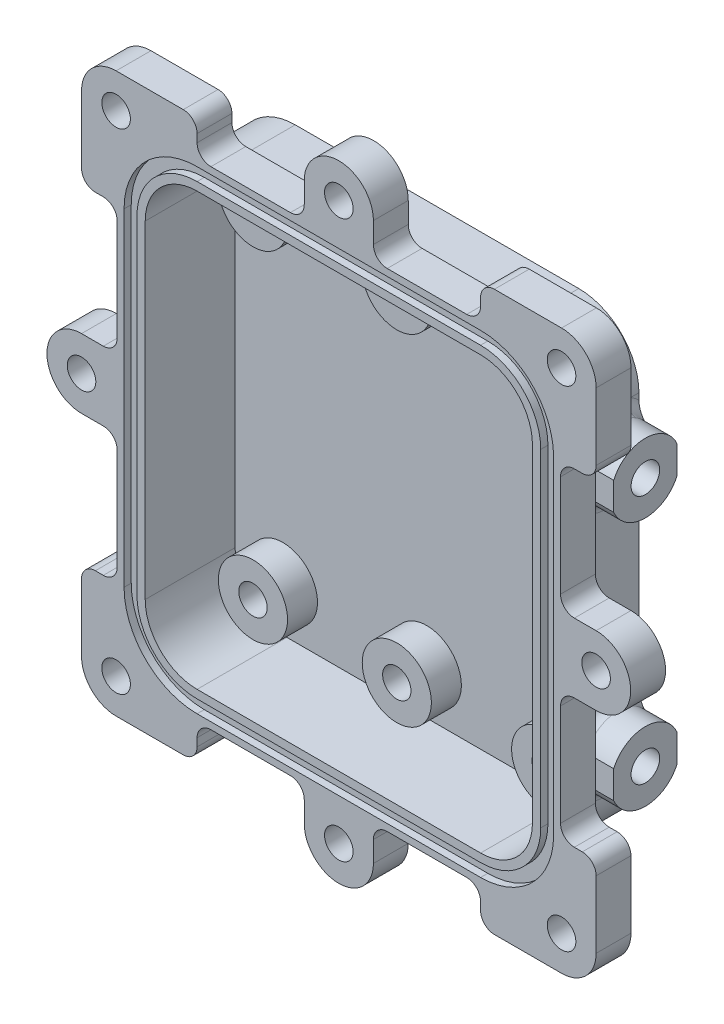
from build123d import *

# Parameters (mm, degrees)
BOSS_EXTRUDE1_DEPTH  = 16.51
SHELL1_T             = 1.524
SKETCH2_R            = 6.35
SKETCH2_R_2          = 2.608000118
BOSS_EXTRUDE2_DEPTH  = 5.5
BOSS_EXTRUDE9_DEPTH  = 1.3208
BOSS_EXTRUDE10_START = 5.08
BOSS_EXTRUDE10_DEPTH = 5.08
SKETCH9_R            = 2.625
BOSS_EXTRUDE11_DEPTH = 6.4008
FILLET2_R            = 2.54
SKETCH10_R           = 2.625
BOSS_EXTRUDE12_DEPTH = 7
FILLET3_R            = 2


with BuildPart() as part:
    # Sketch1 → Boss-Extrude1 (new body)
    with BuildSketch(Plane.XY):
        with BuildLine():
            Line((26.034999985, 143.509994751), (78.104997498, 143.509994751))
            ThreePointArc((78.104997498, 143.509994751), (84.840189588, 140.720186842), (87.629997498, 133.984994751))
            Line((87.629997498, 133.984994751), (87.629997498, 73.787000793))
            ThreePointArc((87.629997498, 73.787000793), (84.840189588, 67.051808703), (78.104997498, 64.262000793))
            Line((78.104997498, 64.262000793), (26.034999985, 64.262000793))
            ThreePointArc((26.034999985, 64.262000793), (19.299807894, 67.051808703), (16.509999985, 73.787000793))
            Line((16.509999985, 73.787000793), (16.509999985, 133.984994751))
            ThreePointArc((16.509999985, 133.984994751), (19.299807894, 140.720186842), (26.034999985, 143.509994751))
        make_face()
    extrude(amount=BOSS_EXTRUDE1_DEPTH)

    # Shell1
    shell1_openings = [part.faces().sort_by_distance(p)[0] for p in [
        (52.069998741, 103.885997772, 16.51),
    ]]
    offset(amount=SHELL1_T, openings=shell1_openings, kind=Kind.INTERSECTION)

    # Sketch2 → Boss-Extrude2 (add)
    # profile 1 of 6: a face of its own
    with BuildSketch(Plane.XY):
        with Locations(Location((25.292, 135.128, 0), (0, 0, 180))):
            Circle(SKETCH2_R)
        with Locations((25.292, 135.128)):
            Circle(SKETCH2_R_2, mode=Mode.SUBTRACT)
    # profile 2 of 6: a face of its own
    with BuildSketch(Plane.XY):
        with Locations(Location((51.708, 135.128, 0), (0, 0, 180))):
            Circle(SKETCH2_R)
        with Locations((51.708, 135.128)):
            Circle(SKETCH2_R_2, mode=Mode.SUBTRACT)
    # profile 3 of 6: a face of its own
    with BuildSketch(Plane.XY):
        with Locations(Location((79.14, 135.128, 0), (0, 0, 180))):
            Circle(SKETCH2_R)
        with Locations((79.14, 135.128)):
            Circle(SKETCH2_R_2, mode=Mode.SUBTRACT)
    # profile 4 of 6: a face of its own
    with BuildSketch(Plane.XY):
        with Locations(Location((25.292, 72.644, 0), (0, 0, 180))):
            Circle(SKETCH2_R)
        with Locations((25.292, 72.644)):
            Circle(SKETCH2_R_2, mode=Mode.SUBTRACT)
    # profile 5 of 6: a face of its own
    with BuildSketch(Plane.XY):
        with Locations(Location((51.708, 72.644, 0), (0, 0, 180))):
            Circle(SKETCH2_R)
        with Locations((51.708, 72.644)):
            Circle(SKETCH2_R_2, mode=Mode.SUBTRACT)
    # profile 6 of 6: a face of its own
    with BuildSketch(Plane.XY):
        with Locations(Location((79.14, 72.644, 0), (0, 0, 180))):
            Circle(SKETCH2_R)
        with Locations((79.14, 72.644)):
            Circle(SKETCH2_R_2, mode=Mode.SUBTRACT)
    extrude(amount=BOSS_EXTRUDE2_DEPTH)



with BuildPart() as body_2:
    # Sketch7 → Boss-Extrude9 (new body)
    with BuildSketch(Plane.XY.offset(16.51)):
        with BuildLine():
            Line((92.786197498, 73.787000793), (92.786197498, 133.984994751))
            ThreePointArc((92.786197498, 133.984994751), (88.486173574, 144.366170827), (78.104997498, 148.666194751))
            Line((78.104997498, 148.666194751), (26.034999985, 148.666194751))
            ThreePointArc((26.034999985, 148.666194751), (15.653823909, 144.366170827), (11.353799985, 133.984994751))
            Line((11.353799985, 133.984994751), (11.353799985, 73.787000793))
            ThreePointArc((11.353799985, 73.787000793), (15.653823909, 63.405824718), (26.034999985, 59.105800793))
            Line((26.034999985, 59.105800793), (78.104997498, 59.105800793))
            ThreePointArc((78.104997498, 59.105800793), (88.486173574, 63.405824718), (92.786197498, 73.787000793))
        make_face()
        with BuildLine():
            ThreePointArc((26.034999985, 147.396194751), (16.551849521, 143.468145215), (12.623799985, 133.984994751))
            Line((12.623799985, 133.984994751), (12.623799985, 73.787000793))
            ThreePointArc((12.623799985, 73.787000793), (16.551849521, 64.30385033), (26.034999985, 60.375800793))
            Line((26.034999985, 60.375800793), (78.104997498, 60.375800793))
            ThreePointArc((78.104997498, 60.375800793), (87.588147961, 64.30385033), (91.516197498, 73.787000793))
            Line((91.516197498, 73.787000793), (91.516197498, 133.984994751))
            ThreePointArc((91.516197498, 133.984994751), (87.588147961, 143.468145215), (78.104997498, 147.396194751))
            Line((78.104997498, 147.396194751), (26.034999985, 147.396194751))
        make_face(mode=Mode.SUBTRACT)
    extrude(amount=-BOSS_EXTRUDE9_DEPTH)


with BuildPart() as part_1:
    add(part.part)

    add(body_2.part)  # Boss-Extrude10 merges body 2
    # Sketch8 → Boss-Extrude10 (add)
    # profile 1 of 2: a face of its own
    with BuildSketch(Plane(origin=(0, 0, 15.1892), x_dir=(-1, 0, 0), z_dir=(0, 0, -1)).offset(BOSS_EXTRUDE10_START)):
        with BuildLine():
            ThreePointArc((-78.104997498, 148.666194751), (-88.486173574, 144.366170827), (-92.786197498, 133.984994751))
            Line((-92.786197498, 133.984994751), (-92.786197498, 73.787000793))
            ThreePointArc((-92.786197498, 73.787000793), (-88.486173574, 63.405824718), (-78.104997498, 59.105800793))
            Line((-78.104997498, 59.105800793), (-26.034999985, 59.105800793))
            ThreePointArc((-26.034999985, 59.105800793), (-15.653823909, 63.405824718), (-11.353799985, 73.787000793))
            Line((-11.353799985, 73.787000793), (-11.353799985, 133.984994751))
            ThreePointArc((-11.353799985, 133.984994751), (-15.653823909, 144.366170827), (-26.034999985, 148.666194751))
            Line((-26.034999985, 148.666194751), (-78.104997498, 148.666194751))
        make_face()
        with BuildLine():
            Line((-78.104997498, 147.396194751), (-26.034999985, 147.396194751))
            ThreePointArc((-26.034999985, 147.396194751), (-16.551849521, 143.468145215), (-12.623799985, 133.984994751))
            Line((-12.623799985, 133.984994751), (-12.623799985, 73.787000793))
            ThreePointArc((-12.623799985, 73.787000793), (-16.551849521, 64.30385033), (-26.034999985, 60.375800793))
            Line((-26.034999985, 60.375800793), (-78.104997498, 60.375800793))
            ThreePointArc((-78.104997498, 60.375800793), (-87.588147961, 64.30385033), (-91.516197498, 73.787000793))
            Line((-91.516197498, 73.787000793), (-91.516197498, 133.984994751))
            ThreePointArc((-91.516197498, 133.984994751), (-87.588147961, 143.468145215), (-78.104997498, 147.396194751))
        make_face(mode=Mode.SUBTRACT)
    # profile 2 of 2: a face of its own
    with BuildSketch(Plane(origin=(0, 0, 15.1892), x_dir=(-1, 0, 0), z_dir=(0, 0, -1)).offset(BOSS_EXTRUDE10_START)):
        with BuildLine():
            ThreePointArc((-26.034999985, 147.396194751), (-16.551849521, 143.468145215), (-12.623799985, 133.984994751))
            Line((-12.623799985, 133.984994751), (-12.623799985, 73.787000793))
            ThreePointArc((-12.623799985, 73.787000793), (-16.551849521, 64.30385033), (-26.034999985, 60.375800793))
            Line((-26.034999985, 60.375800793), (-78.104997498, 60.375800793))
            ThreePointArc((-78.104997498, 60.375800793), (-87.588147961, 64.30385033), (-91.516197498, 73.787000793))
            Line((-91.516197498, 73.787000793), (-91.516197498, 133.984994751))
            ThreePointArc((-91.516197498, 133.984994751), (-87.588147961, 143.468145215), (-78.104997498, 147.396194751))
            Line((-78.104997498, 147.396194751), (-26.034999985, 147.396194751))
        make_face()
        with BuildLine():
            ThreePointArc((-26.034999985, 62.738000793), (-18.222177159, 65.974177968), (-14.985999985, 73.787000793))
            Line((-14.985999985, 73.787000793), (-14.985999985, 133.984994751))
            ThreePointArc((-14.985999985, 133.984994751), (-18.222177159, 141.797817576), (-26.034999985, 145.033994751))
            Line((-26.034999985, 145.033994751), (-78.104997498, 145.033994751))
            ThreePointArc((-78.104997498, 145.033994751), (-85.917820323, 141.797817576), (-89.153997498, 133.984994751))
            Line((-89.153997498, 133.984994751), (-89.153997498, 73.787000793))
            ThreePointArc((-89.153997498, 73.787000793), (-85.917820323, 65.974177968), (-78.104997498, 62.738000793))
            Line((-78.104997498, 62.738000793), (-26.034999985, 62.738000793))
        make_face(mode=Mode.SUBTRACT)
    extrude(amount=-BOSS_EXTRUDE10_DEPTH)

    # Sketch9 → Boss-Extrude11 (add)
    # profile 1 of 8: a face of its own
    with BuildSketch(Plane.XY.offset(16.51)):
        with BuildLine():
            Line((11.163695848, 155.206298887), (26.034999985, 155.206298887))
            Line((26.034999985, 155.206298887), (26.034999985, 148.666194751))
            ThreePointArc((26.034999985, 148.666194751), (15.653823909, 144.366170827), (11.353799985, 133.984994751))
            Line((11.353799985, 133.984994751), (4.813695848, 133.984994751))
            Line((4.813695848, 133.984994751), (4.813695848, 148.856298887))
            ThreePointArc((4.813695848, 148.856298887), (6.673567788, 153.346426948), (11.163695848, 155.206298887))
        make_face()
        with Locations((11.163695848, 148.856298887)):
            Circle(SKETCH9_R, mode=Mode.SUBTRACT)
    # profile 2 of 8: a face of its own
    with BuildSketch(Plane.XY.offset(16.51)):
        with BuildLine():
            Line((45.719998741, 155.016194751), (45.719998741, 148.666194751))
            Line((45.719998741, 148.666194751), (58.419998741, 148.666194751))
            Line((58.419998741, 148.666194751), (58.419998741, 155.016194751))
            ThreePointArc((58.419998741, 155.016194751), (52.069998741, 161.366194751), (45.719998741, 155.016194751))
        make_face()
        with Locations((52.069998741, 155.016194751)):
            Circle(SKETCH9_R, mode=Mode.SUBTRACT)
    # profile 3 of 8: a face of its own
    with BuildSketch(Plane.XY.offset(16.51)):
        with BuildLine():
            Line((4.813695848, 110.235997772), (11.353799985, 110.235997772))
            Line((11.353799985, 110.235997772), (11.353799985, 97.535997772))
            Line((11.353799985, 97.535997772), (4.813695848, 97.535997772))
            ThreePointArc((4.813695848, 97.535997772), (-1.536304152, 103.885997772), (4.813695848, 110.235997772))
        make_face()
        with Locations((4.813695848, 103.885997772)):
            Circle(SKETCH9_R, mode=Mode.SUBTRACT)
    # profile 4 of 8: a face of its own
    with BuildSketch(Plane.XY.offset(16.51)):
        with BuildLine():
            Line((92.786197498, 133.984994751), (99.326301634, 133.984994751))
            Line((99.326301634, 133.984994751), (99.326301634, 148.856298887))
            ThreePointArc((99.326301634, 148.856298887), (97.466429695, 153.346426948), (92.976301634, 155.206298887))
            Line((92.976301634, 155.206298887), (78.104997498, 155.206298887))
            Line((78.104997498, 155.206298887), (78.104997498, 148.666194751))
            ThreePointArc((78.104997498, 148.666194751), (88.486173574, 144.366170827), (92.786197498, 133.984994751))
        make_face()
        with Locations(Location((92.976301634, 148.856298887, 0), (0, 0, 180))):
            Circle(SKETCH9_R, mode=Mode.SUBTRACT)
    # profile 5 of 8: a face of its own
    with BuildSketch(Plane.XY.offset(16.51)):
        with BuildLine():
            Line((78.104997498, 52.565696657), (78.104997498, 59.105800793))
            ThreePointArc((78.104997498, 59.105800793), (88.486173574, 63.405824718), (92.786197498, 73.787000793))
            Line((92.786197498, 73.787000793), (99.326301634, 73.787000793))
            Line((99.326301634, 73.787000793), (99.326301634, 58.915696657))
            ThreePointArc((99.326301634, 58.915696657), (97.466429695, 54.425568596), (92.976301634, 52.565696657))
            Line((92.976301634, 52.565696657), (78.104997498, 52.565696657))
        make_face()
        with Locations((92.976301634, 58.915696657)):
            Circle(SKETCH9_R, mode=Mode.SUBTRACT)
    # profile 6 of 8: a face of its own
    with BuildSketch(Plane.XY.offset(16.51)):
        with BuildLine():
            Line((58.419998741, 59.105800793), (58.419998741, 52.755800793))
            ThreePointArc((58.419998741, 52.755800793), (52.069998741, 46.405800793), (45.719998741, 52.755800793))
            Line((45.719998741, 52.755800793), (45.719998741, 59.105800793))
            Line((45.719998741, 59.105800793), (58.419998741, 59.105800793))
        make_face()
        with Locations(Location((52.069998741, 52.755800793, 0), (0, 0, 180))):
            Circle(SKETCH9_R, mode=Mode.SUBTRACT)
    # profile 7 of 8: a face of its own
    with BuildSketch(Plane.XY.offset(16.51)):
        with BuildLine():
            Line((11.353799985, 73.787000793), (4.813695848, 73.787000793))
            Line((4.813695848, 73.787000793), (4.813695848, 58.915696657))
            ThreePointArc((4.813695848, 58.915696657), (6.673567788, 54.425568596), (11.163695848, 52.565696657))
            Line((11.163695848, 52.565696657), (26.034999985, 52.565696657))
            Line((26.034999985, 52.565696657), (26.034999985, 59.105800793))
            ThreePointArc((26.034999985, 59.105800793), (15.653823909, 63.405824718), (11.353799985, 73.787000793))
        make_face()
        with Locations(Location((11.163695848, 58.915696657, 0), (0, 0, 180))):
            Circle(SKETCH9_R, mode=Mode.SUBTRACT)
    # profile 8 of 8: a face of its own
    with BuildSketch(Plane.XY.offset(16.51)):
        with BuildLine():
            Line((99.326301634, 110.235997772), (92.786197498, 110.235997772))
            Line((92.786197498, 110.235997772), (92.786197498, 97.535997772))
            Line((92.786197498, 97.535997772), (99.326301634, 97.535997772))
            ThreePointArc((99.326301634, 97.535997772), (105.676301634, 103.885997772), (99.326301634, 110.235997772))
        make_face()
        with Locations(Location((99.326301634, 103.885997772, 0), (0, 0, 180))):
            Circle(SKETCH9_R, mode=Mode.SUBTRACT)
    extrude(amount=-BOSS_EXTRUDE11_DEPTH)

    # Fillet2
    fillet2_edges = [part_1.edges().sort_by_distance(p)[0] for p in [
        (78.104997498, 148.666194751, 13.3096),
        (92.786197498, 133.984994751, 13.3096),
        (92.786197498, 73.787000793, 13.3096),
        (78.104997498, 59.105800793, 13.3096),
        (26.034999985, 59.105800793, 13.3096),
        (11.353799985, 73.787000793, 13.3096),
        (11.353799985, 133.984994751, 13.3096),
        (26.034999985, 148.666194751, 13.3096),
        (58.419998741, 148.666194751, 13.3096),
        (45.719998741, 148.666194751, 13.3096),
        (11.353799985, 110.235997772, 13.3096),
        (11.353799985, 97.535997772, 13.3096),
        (99.326301634, 73.787000793, 13.3096),
        (78.104997498, 52.565696657, 13.3096),
        (26.034999985, 155.206298887, 13.3096),
        (4.813695848, 133.984994751, 13.3096),
        (78.104997498, 155.206298887, 13.3096),
        (99.326301634, 133.984994751, 13.3096),
        (45.719998741, 59.105800793, 13.3096),
        (58.419998741, 59.105800793, 13.3096),
        (26.034999985, 52.565696657, 13.3096),
        (4.813695848, 73.787000793, 13.3096),
        (92.786197498, 97.535997772, 13.3096),
        (92.786197498, 110.235997772, 13.3096),
    ]]
    fillet(fillet2_edges, radius=FILLET2_R)

    # Sketch10 → Boss-Extrude12 (add)
    # profile 1 of 2: a face of its own
    with BuildSketch(Plane(origin=(89.153997498, 0, 0), x_dir=(0, 0, -1), z_dir=(1, 0, 0))):
        with BuildLine():
            Line((-10.1092, 129.367758723), (-10.1092, 124.272794763))
            ThreePointArc((-10.1092, 124.272794763), (-4.2926, 120.470276743), (1.524, 124.272794763))
            Line((1.524, 124.272794763), (1.524, 129.367758723))
            ThreePointArc((1.524, 129.367758723), (-4.2926, 133.170276743), (-10.1092, 129.367758723))
        make_face()
        with Locations((-4.2926, 126.820276743)):
            Circle(SKETCH10_R, mode=Mode.SUBTRACT)
    # profile 2 of 2: a face of its own
    with BuildSketch(Plane(origin=(89.153997498, 0, 0), x_dir=(0, 0, -1), z_dir=(1, 0, 0))):
        with BuildLine():
            Line((-10.1092, 78.404236821), (-10.1092, 83.499200782))
            ThreePointArc((-10.1092, 83.499200782), (-4.2926, 87.301718801), (1.524, 83.499200782))
            Line((1.524, 83.499200782), (1.524, 78.404236821))
            ThreePointArc((1.524, 78.404236821), (-4.2926, 74.601718801), (-10.1092, 78.404236821))
        make_face()
        with Locations((-4.2926, 80.951718801)):
            Circle(SKETCH10_R, mode=Mode.SUBTRACT)
    boss_extrude12 = extrude(amount=BOSS_EXTRUDE12_DEPTH)

    # Mirror1: Boss-Extrude12 across plane
    add(boss_extrude12.mirror(Plane(origin=(52.069998741, 0, 0), x_dir=(0, 0, 1), z_dir=(1, 0, 0))))

    # Fillet3
    fillet3_edges = [part_1.edges().sort_by_distance(p)[0] for p in [
        (89.153997498, 120.470276743, 4.2926),
        (89.153997498, 133.170276743, 4.2926),
        (89.153997498, 74.601718801, 4.2926),
        (89.153997498, 87.301718801, 4.2926),
        (14.985999985, 120.470276743, 4.2926),
        (14.985999985, 133.170276743, 4.2926),
        (14.985999985, 74.601718801, 4.2926),
        (14.985999985, 87.301718801, 4.2926),
    ]]
    fillet(fillet3_edges, radius=FILLET3_R)


solid = part_1.part
